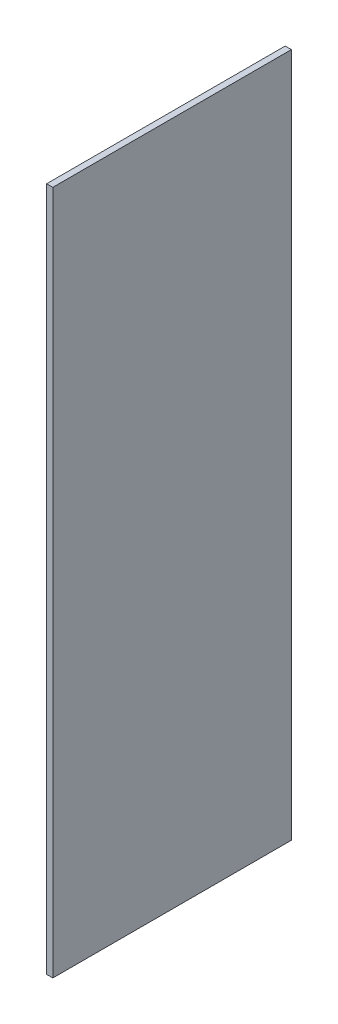
from build123d import *

# Parameters (mm, degrees)
SKETCH1_W           = 154
SKETCH1_H           = 442
BOSS_EXTRUDE1_DEPTH = 4


with BuildPart() as part:
    # Sketch1 → Boss-Extrude1 (new body)
    with BuildSketch(Plane(origin=(0, 0, 0), x_dir=(0, 0, -1), z_dir=(1, 0, 0))):
        with Locations((77, 221)):
            Rectangle(SKETCH1_W, SKETCH1_H)
    extrude(amount=BOSS_EXTRUDE1_DEPTH)


solid = part.part
